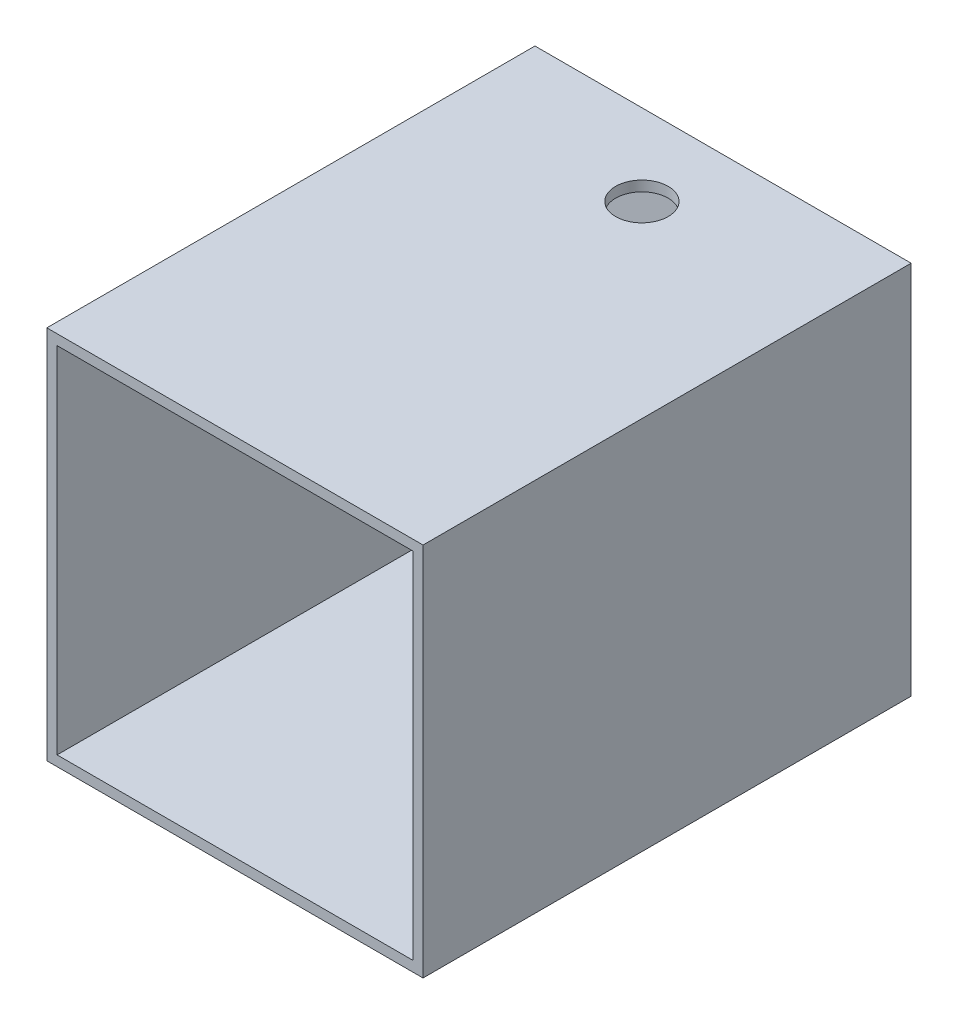
from build123d import *

# Parameters (mm, degrees)
CROQUIS1_W              = 157.6
CROQUIS1_H              = 157.1
CROQUIS1_W_2            = 149
CROQUIS1_H_2            = 148.5
SALIENTE_EXTRUIR1_DEPTH = 204.5
CROQUIS2_W              = 4
CROQUIS2_H              = 157.1
SALIENTE_EXTRUIR2_DEPTH = 149
CROQUIS3_R              = 11
CORTAR_EXTRUIR1_DEPTH   = 270.648104017


with BuildPart() as part:
    # Croquis1 → Saliente-Extruir1 (new body)
    with BuildSketch(Plane.XY):
        Rectangle(CROQUIS1_W, CROQUIS1_H)
        Rectangle(CROQUIS1_W_2, CROQUIS1_H_2, mode=Mode.SUBTRACT)
    extrude(amount=SALIENTE_EXTRUIR1_DEPTH)

    # Croquis2 → Saliente-Extruir2 (add)
    with BuildSketch(Plane(origin=(-74.5, 0, 0), x_dir=(0, 0, -1), z_dir=(1, 0, 0))):
        with Locations((-2, 0)):
            Rectangle(CROQUIS2_W, CROQUIS2_H)
    extrude(amount=SALIENTE_EXTRUIR2_DEPTH)

    # Croquis3 → Cortar-Extruir1 (cut, through all)
    with BuildSketch(Plane.XZ.offset(78.55)):
        with Locations(Location((0, 34, 0), (0, 0, 270))):
            Circle(CROQUIS3_R)
    extrude(amount=-CORTAR_EXTRUIR1_DEPTH, mode=Mode.SUBTRACT)


solid = part.part
